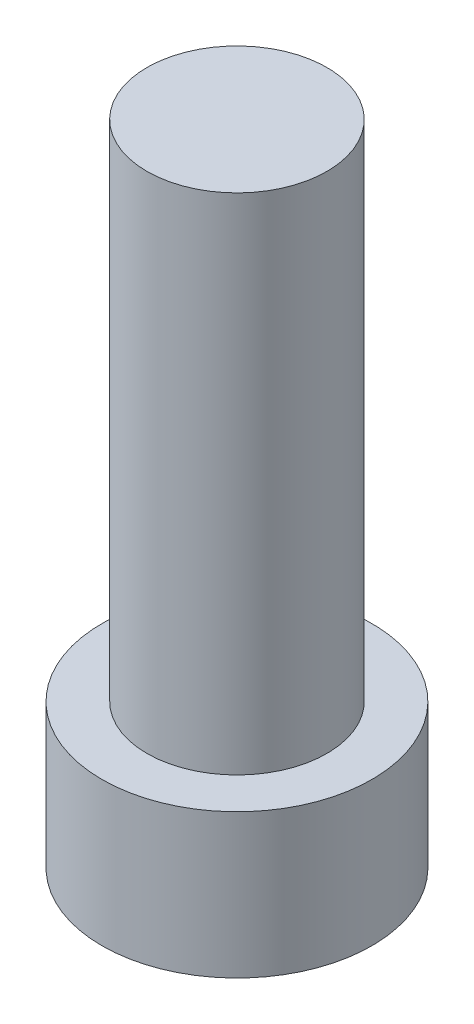
from build123d import *

# Parameters (mm, degrees)
SKETCH_1_R          = 3.75
EXTRUDE_1_DEPTH     = 4
SKETCH_2_R          = 2.5
EXTRUDE_2_DEPTH     = 14
CUT_EXTRUDE_1_DEPTH = 2.5
FILLET_1_R          = 0.1


with BuildPart() as part:
    # 草图1 → 凸台-拉伸1 (new body)
    with BuildSketch(Plane(origin=(0, 0, 0), x_dir=(1, 0, 0), z_dir=(0, 1, 0))):
        with Locations(Location((0, 0, 0), (0, 0, 270))):
            Circle(SKETCH_1_R)
    extrude(amount=EXTRUDE_1_DEPTH)

    # 草图2 → 凸台-拉伸2 (add)
    with BuildSketch(Plane(origin=(0, 4, 0), x_dir=(1, 0, 0), z_dir=(0, 1, 0))):
        with Locations(Location((0, 0, 0), (0, 0, 270))):
            Circle(SKETCH_2_R)
    extrude(amount=EXTRUDE_2_DEPTH)

    # 草图3 → 切除-拉伸1 (cut)
    with BuildSketch(Plane.XZ):
        Polygon((1.241505751, 2.169967667), (-1.258494249, 2.160159352), (-2.5, -0.009808314), (-1.241505751, -2.169967667), (1.258494249, -2.160159352), (2.5, 0.009808314), align=None)
    extrude(amount=-CUT_EXTRUDE_1_DEPTH, mode=Mode.SUBTRACT)

    # 圆角1
    fillet_1_edges = [part.edges().sort_by_distance(p)[0] for p in [
        (1.870752875, 0, 1.089887991),
        (-0.008494249, 0, 2.165063509),
        (-1.879247125, 0, 1.075175519),
        (-1.870752875, 0, -1.089887991),
        (0.008494249, 0, -2.165063509),
        (1.879247125, 0, -1.075175519),
    ]]
    fillet(fillet_1_edges, radius=FILLET_1_R)


solid = part.part
